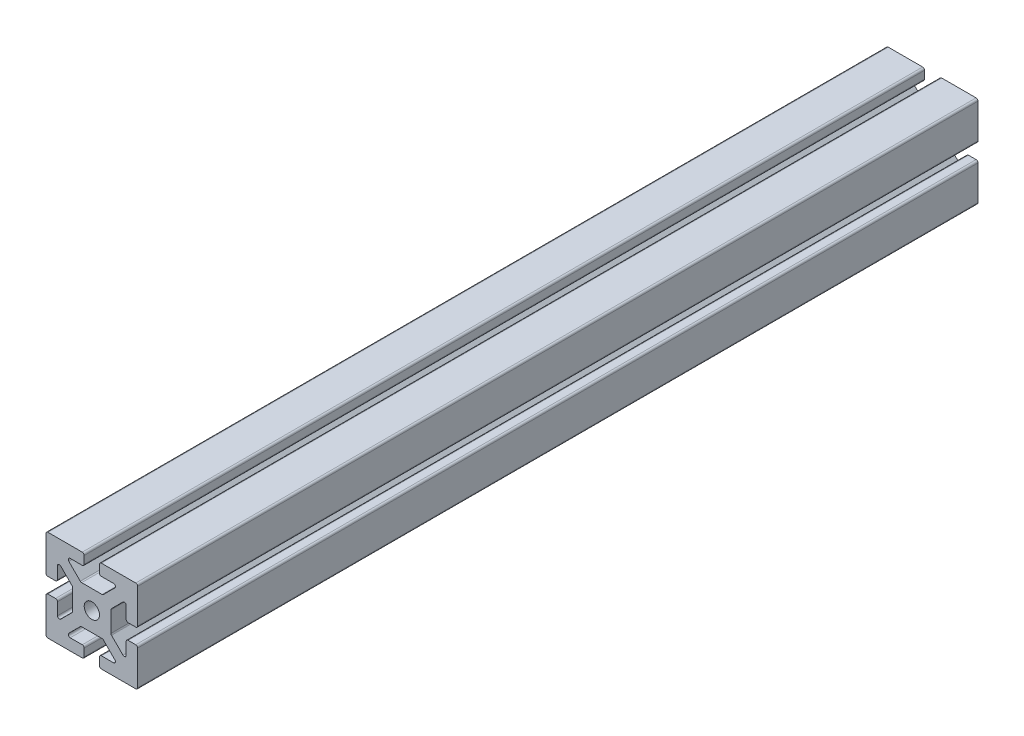
from build123d import *

# Parameters (mm, degrees)
SKETCH1_R           = 1
BOSS_EXTRUDE1_DEPTH = 110


with BuildPart() as part:
    # Sketch1 → Boss-Extrude1 (new body)
    with BuildSketch(Plane.XY):
        with BuildLine():
            Line((-6, 1.25), (-6, 5.75))
            ThreePointArc((-6, 5.75), (-5.926776695, 5.926776695), (-5.75, 6))
            Line((-5.75, 6), (-1.25, 6))
            ThreePointArc((-1.25, 6), (-1.073223305, 5.926776695), (-1, 5.75))
            Line((-1, 5.75), (-1, 4.75))
            ThreePointArc((-1, 4.75), (-1.073223305, 4.573223305), (-1.25, 4.5))
            Line((-1.25, 4.5), (-2.835786438, 4.5))
            ThreePointArc((-2.835786438, 4.5), (-3.066756321, 4.345670858), (-3.012563133, 4.073223305))
            Line((-3.012563133, 4.073223305), (-1.512563133, 2.573223305))
            ThreePointArc((-1.512563133, 2.573223305), (-1.431457296, 2.519030117), (-1.335786438, 2.5))
            Line((-1.335786438, 2.5), (1.335786438, 2.5))
            ThreePointArc((1.335786438, 2.5), (1.431457296, 2.519030117), (1.512563133, 2.573223305))
            Line((1.512563133, 2.573223305), (3.012563133, 4.073223305))
            ThreePointArc((3.012563133, 4.073223305), (3.066756321, 4.345670858), (2.835786438, 4.5))
            Line((2.835786438, 4.5), (1.25, 4.5))
            ThreePointArc((1.25, 4.5), (1.073223305, 4.573223305), (1, 4.75))
            Line((1, 4.75), (1, 5.75))
            ThreePointArc((1, 5.75), (1.073223305, 5.926776695), (1.25, 6))
            Line((1.25, 6), (5.75, 6))
            ThreePointArc((5.75, 6), (5.926776695, 5.926776695), (6, 5.75))
            Line((6, 5.75), (6, 1.25))
            ThreePointArc((6, 1.25), (5.926776695, 1.073223305), (5.75, 1))
            Line((5.75, 1), (4.75, 1))
            ThreePointArc((4.75, 1), (4.573223305, 1.073223305), (4.5, 1.25))
            Line((4.5, 1.25), (4.5, 2.835786438))
            ThreePointArc((4.5, 2.835786438), (4.345670858, 3.066756321), (4.073223305, 3.012563133))
            Line((4.073223305, 3.012563133), (2.573223305, 1.512563133))
            ThreePointArc((2.573223305, 1.512563133), (2.519030117, 1.431457296), (2.5, 1.335786438))
            Line((2.5, 1.335786438), (2.5, -1.335786438))
            ThreePointArc((2.5, -1.335786438), (2.519030117, -1.431457296), (2.573223305, -1.512563133))
            Line((2.573223305, -1.512563133), (4.073223305, -3.012563133))
            ThreePointArc((4.073223305, -3.012563133), (4.345670858, -3.066756321), (4.5, -2.835786438))
            Line((4.5, -2.835786438), (4.5, -1.25))
            ThreePointArc((4.5, -1.25), (4.573223305, -1.073223305), (4.75, -1))
            Line((4.75, -1), (5.75, -1))
            ThreePointArc((5.75, -1), (5.926776695, -1.073223305), (6, -1.25))
            Line((6, -1.25), (6, -5.75))
            ThreePointArc((6, -5.75), (5.926776695, -5.926776695), (5.75, -6))
            Line((5.75, -6), (1.25, -6))
            ThreePointArc((1.25, -6), (1.073223305, -5.926776695), (1, -5.75))
            Line((1, -5.75), (1, -4.75))
            ThreePointArc((1, -4.75), (1.073223305, -4.573223305), (1.25, -4.5))
            Line((1.25, -4.5), (2.835786438, -4.5))
            ThreePointArc((2.835786438, -4.5), (3.066756321, -4.345670858), (3.012563133, -4.073223305))
            Line((3.012563133, -4.073223305), (1.512563133, -2.573223305))
            ThreePointArc((1.512563133, -2.573223305), (1.431457296, -2.519030117), (1.335786438, -2.5))
            Line((1.335786438, -2.5), (-1.439339828, -2.5))
            Line((-1.439339828, -2.5), (-3.012563133, -4.073223305))
            ThreePointArc((-3.012563133, -4.073223305), (-3.066756321, -4.345670858), (-2.835786438, -4.5))
            Line((-2.835786438, -4.5), (-1.25, -4.5))
            ThreePointArc((-1.25, -4.5), (-1.073223305, -4.573223305), (-1, -4.75))
            Line((-1, -4.75), (-1, -5.75))
            ThreePointArc((-1, -5.75), (-1.073223305, -5.926776695), (-1.25, -6))
            Line((-1.25, -6), (-5.75, -6))
            ThreePointArc((-5.75, -6), (-5.926776695, -5.926776695), (-6, -5.75))
            Line((-6, -5.75), (-6, -1.25))
            ThreePointArc((-6, -1.25), (-5.926776695, -1.073223305), (-5.75, -1))
            Line((-5.75, -1), (-4.75, -1))
            ThreePointArc((-4.75, -1), (-4.573223305, -1.073223305), (-4.5, -1.25))
            Line((-4.5, -1.25), (-4.5, -2.835786438))
            ThreePointArc((-4.5, -2.835786438), (-4.345670858, -3.066756321), (-4.073223305, -3.012563133))
            Line((-4.073223305, -3.012563133), (-2.573223305, -1.512563133))
            ThreePointArc((-2.573223305, -1.512563133), (-2.519030117, -1.431457296), (-2.5, -1.335786438))
            Line((-2.5, -1.335786438), (-2.5, 1.335786438))
            ThreePointArc((-2.5, 1.335786438), (-2.519030117, 1.431457296), (-2.573223305, 1.512563133))
            Line((-2.573223305, 1.512563133), (-4.073223305, 3.012563133))
            ThreePointArc((-4.073223305, 3.012563133), (-4.345670858, 3.066756321), (-4.5, 2.835786438))
            Line((-4.5, 2.835786438), (-4.5, 1.25))
            ThreePointArc((-4.5, 1.25), (-4.573223305, 1.073223305), (-4.75, 1))
            Line((-4.75, 1), (-5.75, 1))
            ThreePointArc((-5.75, 1), (-5.926776695, 1.073223305), (-6, 1.25))
        make_face()
        Circle(SKETCH1_R, mode=Mode.SUBTRACT)
    extrude(amount=-BOSS_EXTRUDE1_DEPTH)


solid = part.part
